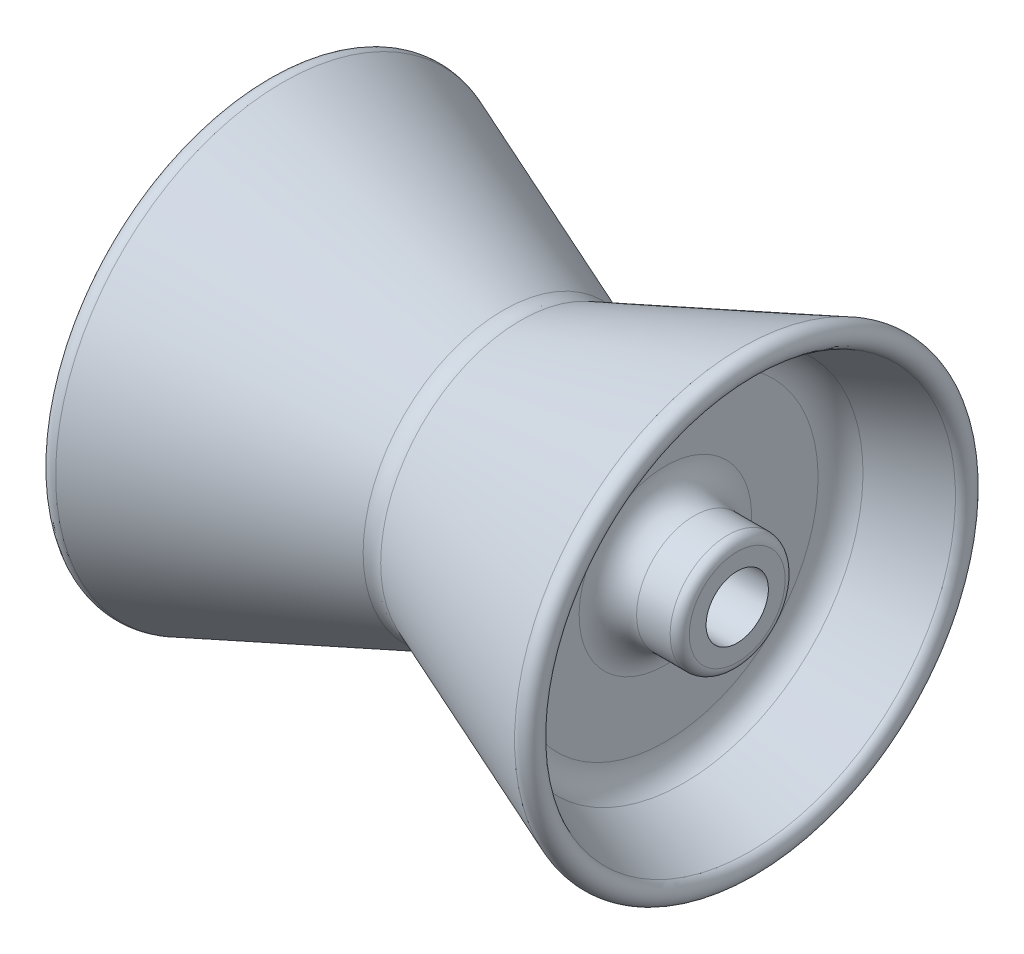
from build123d import *


with BuildPart() as part:
    # Sketch1 → Revolve2 (revolve)
    with BuildSketch(Plane.XY, mode=Mode.PRIVATE) as revolve2_sk:
        with BuildLine():
            ThreePointArc((-9.152458329, 146.176259793), (0, 144.440664074), (9.152458329, 146.176259793))
            Line((9.152458329, 146.176259793), (239.439905947, 236.773734057))
            ThreePointArc((239.439905947, 236.773734057), (255, 230), (248.226265943, 214.439905947))
            Line((248.226265943, 214.439905947), (179.017050005, 187.212281408))
            ThreePointArc((179.017050005, 187.212281408), (165.20596342, 176.184512253), (160, 159.294996272))
            Line((160, 159.294996272), (160, 90))
            ThreePointArc((160, 90), (168.786796564, 68.786796564), (190, 60))
            Line((190, 60), (225, 60))
            ThreePointArc((225, 60), (232.071067812, 57.071067812), (235, 50))
            Line((235, 50), (235, 32.5))
            Line((235, 32.5), (130, 32.5))
            Line((130, 32.5), (130, 121.01661546))
            ThreePointArc((130, 121.01661546), (117.734440322, 145.21350837), (90.967358235, 149.624505679))
            Line((90.967358235, 149.624505679), (15.054402941, 125.655784979))
            ThreePointArc((15.054402941, 125.655784979), (0, 123.335602009), (-15.054402941, 125.655784979))
            Line((-15.054402941, 125.655784979), (-90.967358235, 149.624505679))
            ThreePointArc((-90.967358235, 149.624505679), (-117.734440322, 145.21350837), (-130, 121.01661546))
            Line((-130, 121.01661546), (-130, 32.5))
            Line((-130, 32.5), (-235, 32.5))
            Line((-235, 32.5), (-235, 50))
            ThreePointArc((-235, 50), (-232.071067812, 57.071067812), (-225, 60))
            Line((-225, 60), (-190, 60))
            ThreePointArc((-190, 60), (-168.786796564, 68.786796564), (-160, 90))
            Line((-160, 90), (-160, 159.294996272))
            ThreePointArc((-160, 159.294996272), (-165.20596342, 176.184512253), (-179.017050005, 187.212281408))
            Line((-179.017050005, 187.212281408), (-248.226265943, 214.439905947))
            ThreePointArc((-248.226265943, 214.439905947), (-255, 230), (-239.439905947, 236.773734057))
            Line((-239.439905947, 236.773734057), (-9.152458329, 146.176259793))
        make_face()
    revolve(revolve2_sk.sketch.rotate(Axis((-0.030843915, 0, 0), (1, 0, 0)), 180), axis=Axis((-0.030843915, 0, 0), (1, 0, 0)))


solid = part.part
